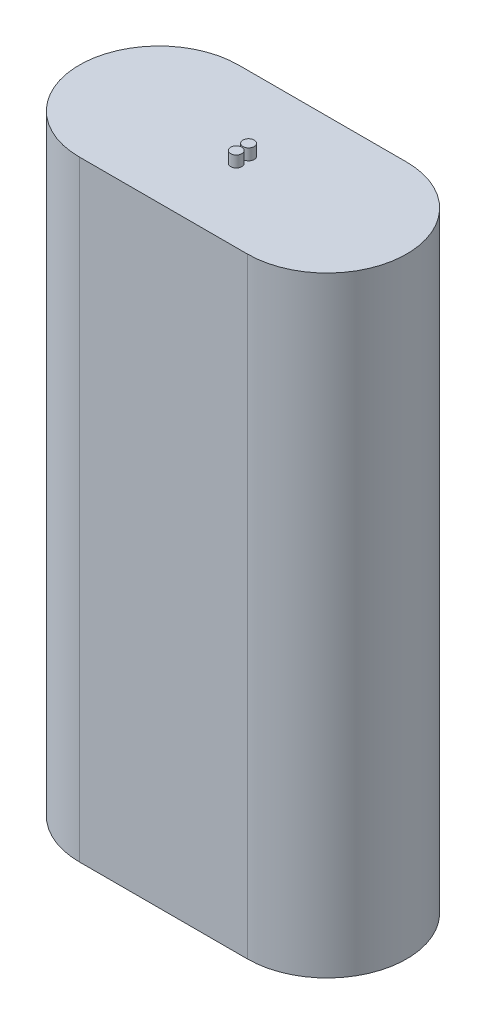
from build123d import *

# Parameters (mm, degrees)
SKETCH1_W           = 19
SKETCH1_H           = 18
BOSS_EXTRUDE1_DEPTH = 69
SKETCH2_R           = 0.635
BOSS_EXTRUDE2_DEPTH = 1.27
SKETCH3_R           = 0.635
BOSS_EXTRUDE4_DEPTH = 1.27


with BuildPart() as part:
    # Sketch1 → Boss-Extrude1 (new body)
    with BuildSketch(Plane(origin=(0, 0, 0), x_dir=(1, 0, 0), z_dir=(0, 1, 0))):
        with BuildLine():
            Line((0, 0), (0, 18))
            ThreePointArc((0, 18), (-9, 9), (0, 0))
        make_face()
        with Locations((9.5, 9)):
            Rectangle(SKETCH1_W, SKETCH1_H)
        with BuildLine():
            Line((19, 0), (19, 18))
            ThreePointArc((19, 18), (28, 9), (19, 0))
        make_face()
    extrude(amount=BOSS_EXTRUDE1_DEPTH)

    # Sketch2 → Boss-Extrude2 (add)
    with BuildSketch(Plane(origin=(0, 69, 0), x_dir=(1, 0, 0), z_dir=(0, 1, 0))):
        with Locations(Location((9.5, 9.635, 0), (0, 0, 270))):
            Circle(SKETCH2_R)
    extrude(amount=BOSS_EXTRUDE2_DEPTH)

    # Sketch3 → Boss-Extrude4 (add)
    with BuildSketch(Plane(origin=(0, 69, 0), x_dir=(1, 0, 0), z_dir=(0, 1, 0))):
        with Locations(Location((9.5, 8.238, 0), (0, 0, 270))):
            Circle(SKETCH3_R)
    extrude(amount=BOSS_EXTRUDE4_DEPTH)


solid = part.part
